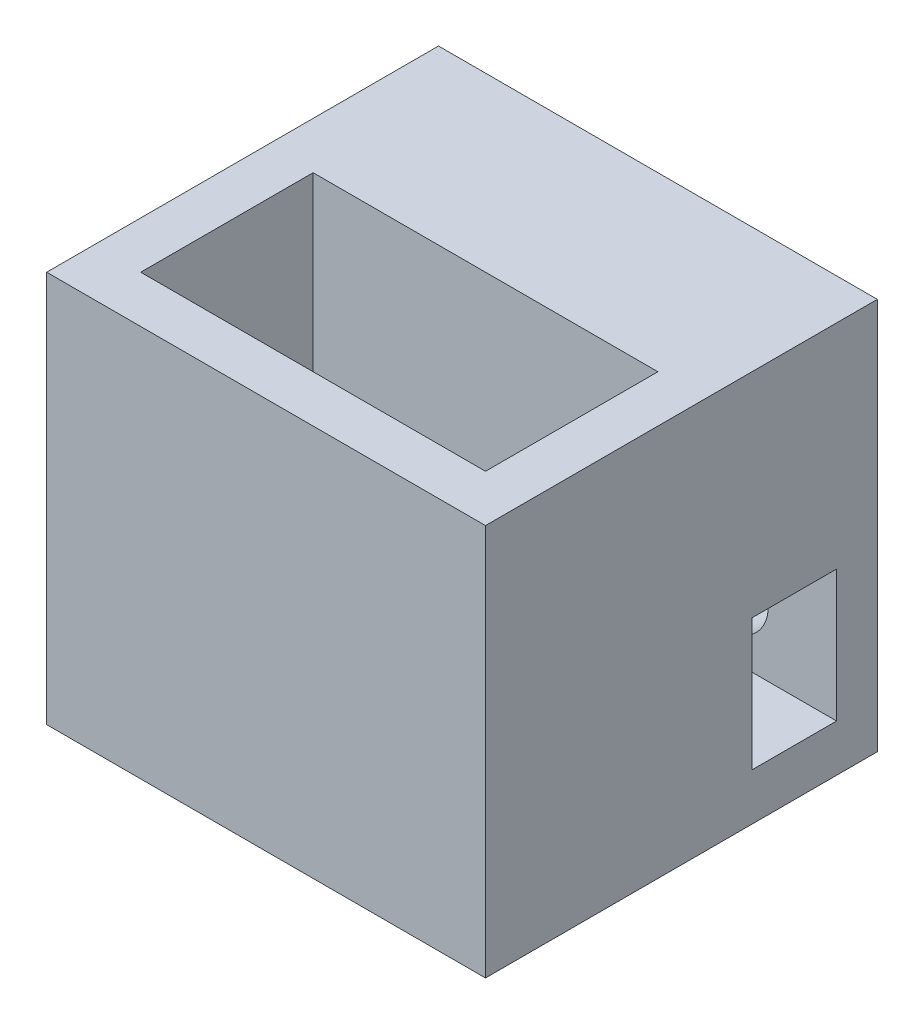
from build123d import *

# Parameters (mm, degrees)
SKETCH1_W                = 22
SKETCH1_H                = 11
BOSS_EXTRUDE1_DEPTH      = 23
SKETCH2_W                = 28
SKETCH2_H                = 17
SKETCH2_R                = 3
BOSS_EXTRUDE2_DEPTH      = 2
BOSS_EXTRUDE7_DEPTH      = 28
BOSS_EXTRUDE8_REACH      = 37.025
M5_CLEARANCE_HOLE2_D     = 5.3
M5_CLEARANCE_HOLE2_DEPTH = 2.6


with BuildPart() as part:
    # Sketch1 → Boss-Extrude1 (new body)
    with BuildSketch(Plane(origin=(0, 0, 0), x_dir=(1, 0, 0), z_dir=(0, 1, 0))):
        Polygon((-14, 8.5), (0, 8.5), (14, 8.5), (14, -8.5), (0, -8.5), (-14, -8.5), align=None)
        Rectangle(SKETCH1_W, SKETCH1_H, mode=Mode.SUBTRACT)
    extrude(amount=BOSS_EXTRUDE1_DEPTH)

    # Sketch2 → Boss-Extrude2 (add)
    with BuildSketch(Plane.XZ):
        Rectangle(SKETCH2_W, SKETCH2_H)
        with Locations(Location((-5.5, 0, 0), (0, 0, 270))):
            Circle(SKETCH2_R, mode=Mode.SUBTRACT)
        with Locations(Location((5.5, 0, 0), (0, 0, 270))):
            Circle(SKETCH2_R, mode=Mode.SUBTRACT)
    extrude(amount=BOSS_EXTRUDE2_DEPTH)

    # Sketch10 → Boss-Extrude7 (add, through all)
    with BuildSketch(Plane(origin=(14, 0, 0), x_dir=(0, 0, -1), z_dir=(1, 0, 0))):
        Polygon((16.5, 23), (8.5, 23), (8.5, 9.4), (13.9, 9.4), (13.9, 1), (8.5, 1), (8.5, -2), (16.5, -2), align=None)
    extrude(amount=-BOSS_EXTRUDE7_DEPTH)

    # Sketch11 → Boss-Extrude8 (add, up to next)
    with BuildSketch(Plane.XY.offset(-13.9), mode=Mode.PRIVATE) as boss_extrude8_sk1:
        Polygon((4.575128869, 1), (2.150257739, 5.2), (4.575128869, 9.4), (-4.575128869, 9.4), (-2.150257739, 5.2), (-4.575128869, 1), align=None)
    boss_extrude8_tool1 = extrude(boss_extrude8_sk1.sketch, amount=BOSS_EXTRUDE8_REACH, mode=Mode.PRIVATE) - part.part
    add(boss_extrude8_tool1.solids().sort_by_distance((0, 5.2, -13.9))[0])

    # M5 Clearance Hole2
    with Locations(Plane.XY.offset(-13.9)):
        with Locations((-7, 5.2), (7, 5.2)):
            Hole(M5_CLEARANCE_HOLE2_D / 2, depth=M5_CLEARANCE_HOLE2_DEPTH)


solid = part.part
